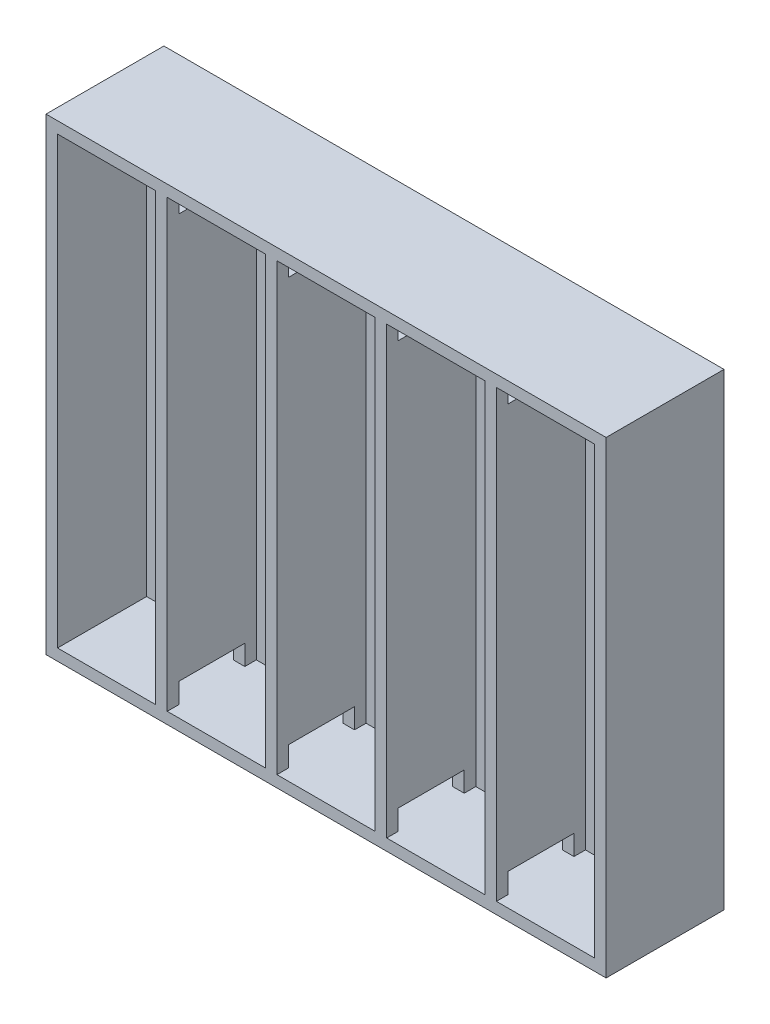
from build123d import *

# Parameters (mm, degrees)
SKETCH1_W           = 95.192719723
SKETCH1_H           = 77.236030742
BOSS_EXTRUDE1_DEPTH = 5
SKETCH2_W           = 20.458340989
SKETCH2_H           = 77.236030742
BOSS_EXTRUDE2_DEPTH = 2
SKETCH3_W           = 97.192719723
SKETCH3_H           = 20.458340989
BOSS_EXTRUDE3_DEPTH = 2
SKETCH4_W           = 97.192719723
SKETCH4_H           = 20.458340989
BOSS_EXTRUDE4_DEPTH = 2
LPATTERN1_COUNT     = 6
LPATTERN1_PITCH     = 19.038543945
CUT_EXTRUDE1_REACH  = 115.159
SKETCH7_W           = 11.458340989
SKETCH7_H           = 3.5


with BuildPart() as part:
    # Sketch1 → Boss-Extrude1 (new body)
    with BuildSketch(Plane.XY):
        with Locations((47.596359862, -38.618015371)):
            Rectangle(SKETCH1_W, SKETCH1_H)
    extrude(amount=BOSS_EXTRUDE1_DEPTH)

    # Sketch2 → Boss-Extrude2 (add)
    with BuildSketch(Plane.ZY):
        with Locations((10.229170494, -38.618015371)):
            Rectangle(SKETCH2_W, SKETCH2_H)
    boss_extrude2 = extrude(amount=BOSS_EXTRUDE2_DEPTH)

    # Sketch3 → Boss-Extrude3 (add)
    with BuildSketch(Plane(origin=(0, 0, 0), x_dir=(1, 0, 0), z_dir=(0, 1, 0))):
        with Locations((46.596359862, -10.229170494)):
            Rectangle(SKETCH3_W, SKETCH3_H)
    extrude(amount=BOSS_EXTRUDE3_DEPTH)

    # Sketch4 → Boss-Extrude4 (add)
    with BuildSketch(Plane.XZ.offset(77.236030742)):
        with Locations((46.596359862, 10.229170494)):
            Rectangle(SKETCH4_W, SKETCH4_H)
    extrude(amount=BOSS_EXTRUDE4_DEPTH)

    # LPattern1: Boss-Extrude2 ×6
    with Locations(*[(i * LPATTERN1_PITCH, 0, 0) for i in range(1, LPATTERN1_COUNT)]):
        add(boss_extrude2)

    # Cut-Extrude1: up to this face of the body (flat: up to its plane)
    cut_extrude1_end = Plane(part.part.faces().sort_by_distance((76.154175778, -38.618015371, 12.729170494))[0])
    # Sketch7 → Cut-Extrude1 (cut, up to the picked face)
    with BuildSketch(Plane.ZY.offset(-17.038543945), mode=Mode.PRIVATE) as cut_extrude1_sk1:
        with Locations((12.729170494, -1.75)):
            Rectangle(SKETCH7_W, SKETCH7_H)
    cut_extrude1_tool1 = split(extrude(cut_extrude1_sk1.sketch, amount=-CUT_EXTRUDE1_REACH, mode=Mode.PRIVATE), bisect_by=cut_extrude1_end, keep=Keep.BOTH, mode=Mode.PRIVATE)
    # Sketch7 → Cut-Extrude1 (cut, up to the picked face)
    with BuildSketch(Plane.ZY.offset(-17.038543945), mode=Mode.PRIVATE) as cut_extrude1_sk2:
        with Locations((12.729170494, -75.486030742)):
            Rectangle(SKETCH7_W, SKETCH7_H)
    cut_extrude1_tool2 = split(extrude(cut_extrude1_sk2.sketch, amount=-CUT_EXTRUDE1_REACH, mode=Mode.PRIVATE), bisect_by=cut_extrude1_end, keep=Keep.BOTH, mode=Mode.PRIVATE)
    add(cut_extrude1_tool1.solids().sort_by(Axis((17.038544, -1.75, 12.72917), (1, 0, 0)))[0], mode=Mode.SUBTRACT)
    add(cut_extrude1_tool2.solids().sort_by(Axis((17.038544, -75.486031, 12.72917), (1, 0, 0)))[0], mode=Mode.SUBTRACT)


solid = part.part
